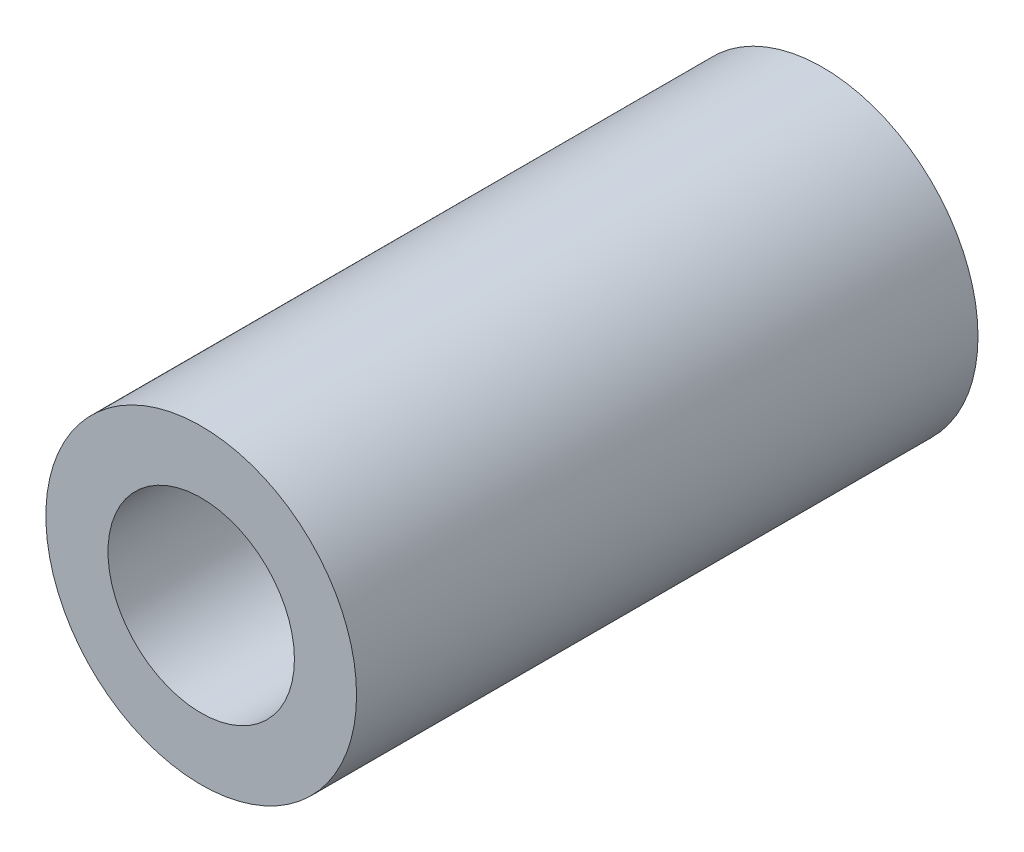
from build123d import *

# Parameters (mm, degrees)
SKETCH_1_R      = 2.5
SKETCH_1_R_2    = 1.5
EXTRUDE_1_DEPTH = 5


with BuildPart() as part:
    # 草图1 → 凸台-拉伸1 (new, symmetric)
    with BuildSketch(Plane.XY):
        Circle(SKETCH_1_R)
        Circle(SKETCH_1_R_2, mode=Mode.SUBTRACT)
    extrude(amount=EXTRUDE_1_DEPTH, both=True)


solid = part.part
